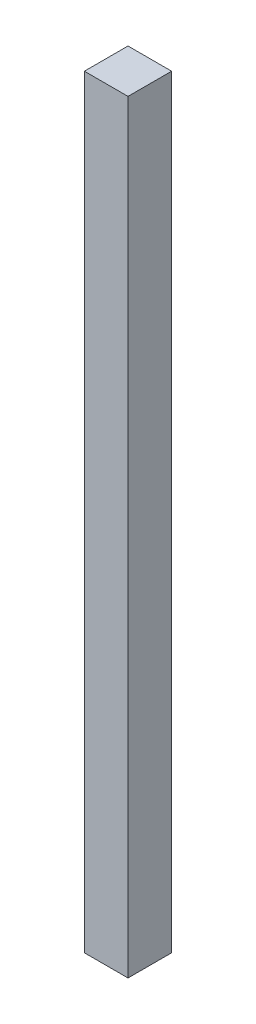
from build123d import *

# Parameters (mm, degrees)
SKETCH_1_W      = 20
SKETCH_1_H      = 20
EXTRUDE_1_DEPTH = 350


with BuildPart() as part:
    # 草图1 → 凸台-拉伸1 (new body)
    with BuildSketch(Plane(origin=(0, 0, 0), x_dir=(1, 0, 0), z_dir=(0, 1, 0))):
        with Locations((10, -10)):
            Rectangle(SKETCH_1_W, SKETCH_1_H)
    extrude(amount=EXTRUDE_1_DEPTH)


solid = part.part
